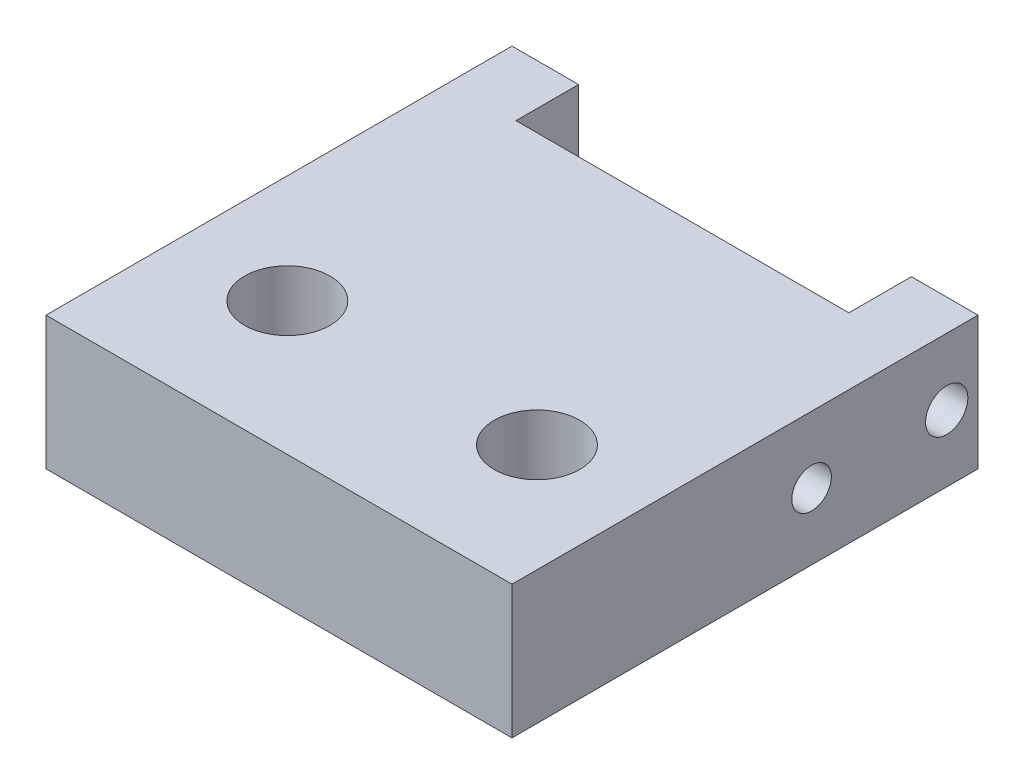
from build123d import *

# Parameters (mm, degrees)
SKETCH1_W             = 17.78
SKETCH1_H             = 17.78
BOSS_EXTRUDE1_DEPTH   = 5.08
SKETCH2_W             = 12.7
SKETCH2_H             = 4.7752
CUT_EXTRUDE1_DEPTH    = 14.55988938
F_4_CLEARANCE_HOLE1_D = 3.2639
F_0_CLEARANCE_HOLE1_D = 1.6129
F_1_72_TAPPED_HOLE1_D = 1.5113


with BuildPart() as part:
    # Sketch1 → Boss-Extrude1 (new body)
    with BuildSketch(Plane(origin=(0, 0, 0), x_dir=(1, 0, 0), z_dir=(0, 1, 0))):
        Rectangle(SKETCH1_W, SKETCH1_H)
    extrude(amount=BOSS_EXTRUDE1_DEPTH)

    # Sketch2 → Cut-Extrude1 (cut, through all)
    with BuildSketch(Plane(origin=(0, 5.08, 0), x_dir=(1, 0, 0), z_dir=(0, 1, 0))):
        with Locations((0, 8.89)):
            Rectangle(SKETCH2_W, SKETCH2_H)
    extrude(amount=-CUT_EXTRUDE1_DEPTH, mode=Mode.SUBTRACT)

    # #4 Clearance Hole1 (through all)
    with Locations(Plane(origin=(0, 5.08, 0), x_dir=(1, 0, 0), z_dir=(0, 1, 0))):
        with Locations((4.7625, -3.81), (-4.7625, -3.81)):
            Hole(F_4_CLEARANCE_HOLE1_D / 2)

    # #0 Clearance Hole1 (through all)
    with Locations(Plane(origin=(8.89, 0, 0), x_dir=(0, 0, -1), z_dir=(1, 0, 0))):
        with Locations((7.6962, 2.54)):
            Hole(F_0_CLEARANCE_HOLE1_D / 2)

    # #1-72 Tapped Hole1 (through all)
    with Locations(Plane(origin=(8.89, 0, 0), x_dir=(0, 0, -1), z_dir=(1, 0, 0))):
        with Locations((2.54, 2.54)):
            Hole(F_1_72_TAPPED_HOLE1_D / 2)


solid = part.part
